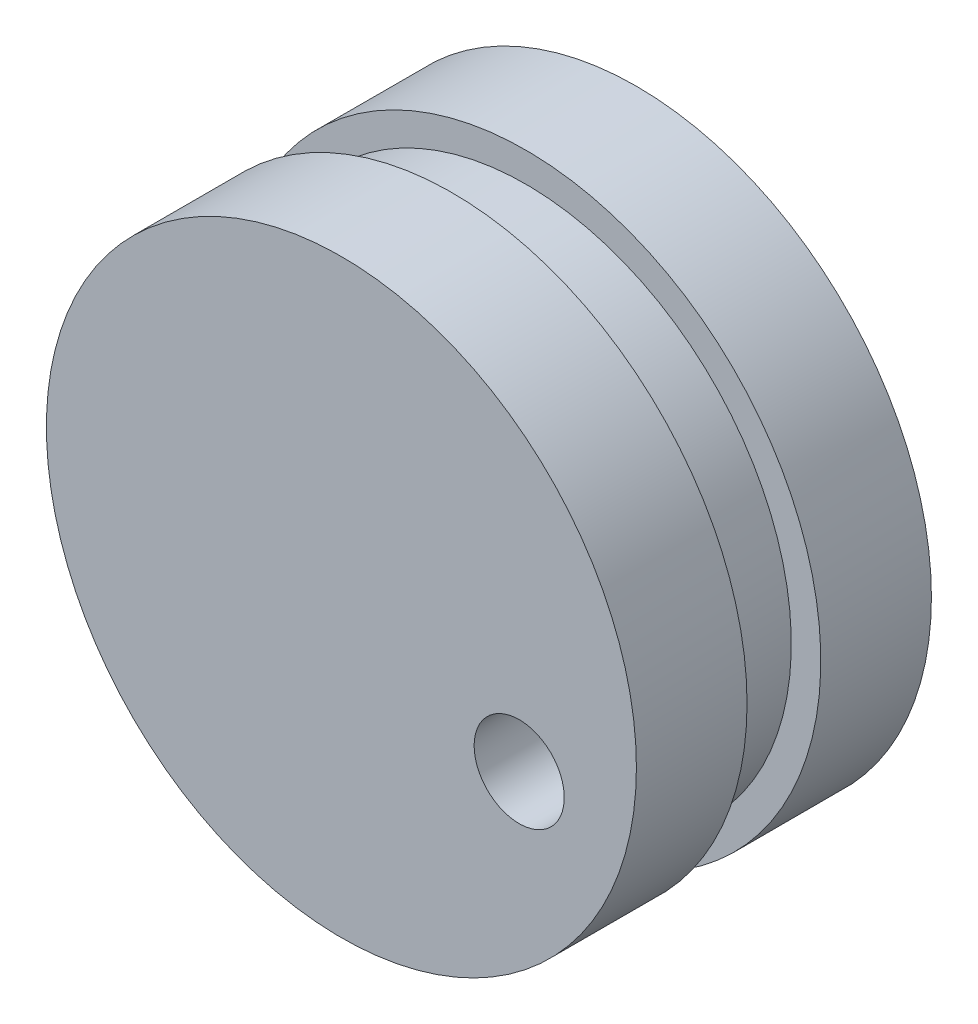
from build123d import *

# Parameters (mm, degrees)
SKETCH1_R           = 20
BOSS_EXTRUDE1_DEPTH = 20
SKETCH4_W           = 5
SKETCH4_H           = 2.912778991
SKETCH5_R           = 3.055550827
CUT_EXTRUDE2_DEPTH  = 35.641016151


with BuildPart() as part:
    # Sketch1 → Boss-Extrude1 (new body)
    with BuildSketch(Plane.XY):
        Circle(SKETCH1_R)
    extrude(amount=BOSS_EXTRUDE1_DEPTH)

    # Sketch4 → Cut-Revolve1 (revolve, cut)
    with BuildSketch(Plane(origin=(0, 0, 0), x_dir=(0, 0, -1), z_dir=(1, 0, 0)), mode=Mode.PRIVATE) as cut_revolve1_sk:
        with Locations((-10, 19.456389495)):
            Rectangle(SKETCH4_W, SKETCH4_H)
    revolve(cut_revolve1_sk.sketch.rotate(Axis((0, 0, 0), (0, 0, 1)), 90), axis=Axis((0, 0, 0), (0, 0, 1)), mode=Mode.SUBTRACT)

    # Sketch5 → Cut-Extrude2 (cut, through all)
    with BuildSketch(Plane(origin=(0, 0, 0), x_dir=(-1, 0, 0), z_dir=(0, 0, -1))):
        with Locations((-12.052497778, -4.218156491)):
            Circle(SKETCH5_R)
    extrude(amount=-CUT_EXTRUDE2_DEPTH, mode=Mode.SUBTRACT)


solid = part.part
